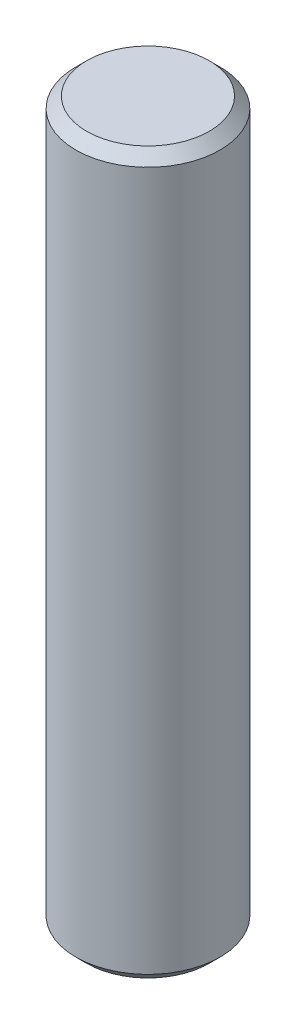
from build123d import *

# Parameters (mm, degrees)
SKETCH_1_R      = 2
EXTRUDE_1_DEPTH = 10
CHAMFER_1_SIZE  = 0.3


with BuildPart() as part:
    # 草图1 → 凸台-拉伸1 (new, symmetric)
    with BuildSketch(Plane(origin=(0, 0, 0), x_dir=(1, 0, 0), z_dir=(0, 1, 0))):
        with Locations(Location((0, 0, 0), (0, 0, 270))):
            Circle(SKETCH_1_R)
    extrude(amount=EXTRUDE_1_DEPTH, both=True)

    # 倒角1
    chamfer_1_edges = [part.edges().sort_by_distance(p)[0] for p in [
        (0, -10, -2),
        (0, 10, -2),
    ]]
    chamfer(chamfer_1_edges, length=CHAMFER_1_SIZE)


solid = part.part
